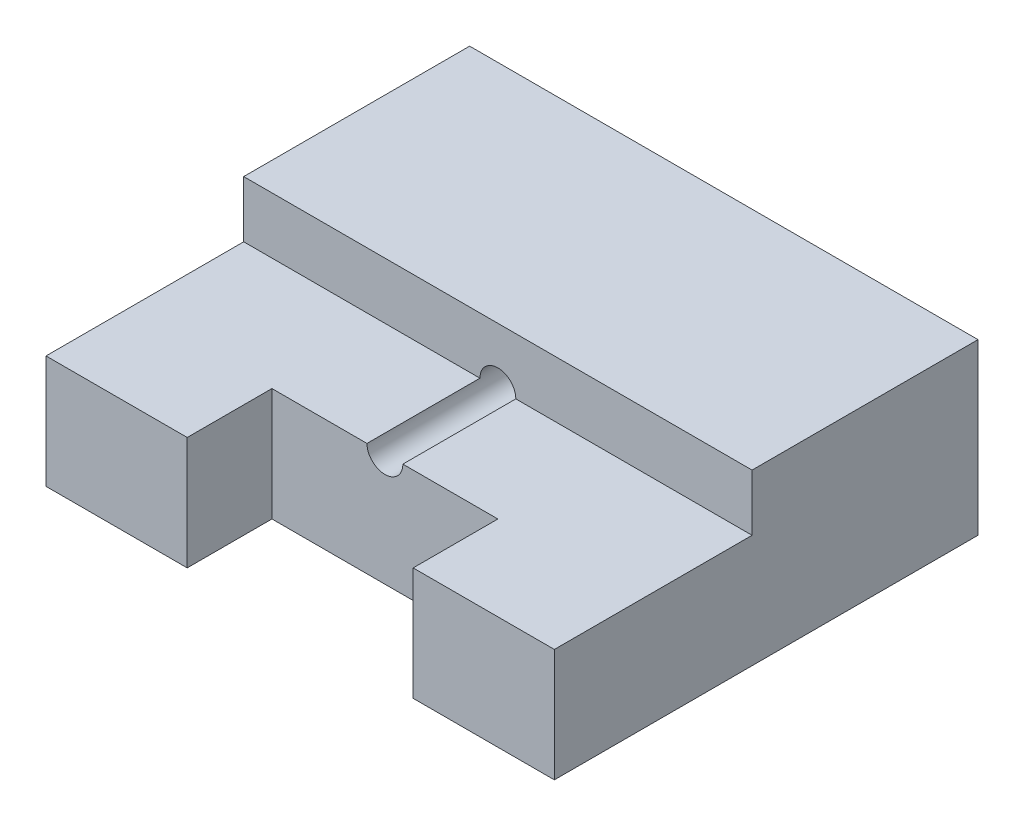
from build123d import *

# Parameters (mm, degrees)
SKETCH2_W           = 18
SKETCH2_H           = 15
BOSS_EXTRUDE2_DEPTH = 6
CUT_EXTRUDE3_DEPTH  = 2
SKETCH7_W           = 8
SKETCH7_H           = 3
CUT_EXTRUDE4_DEPTH  = 24.769728648
SKETCH12_R          = 0.635
CUT_EXTRUDE5_DEPTH  = 25.186773245


with BuildPart() as part:
    # Sketch2 → Boss-Extrude2 (new body)
    with BuildSketch(Plane(origin=(0, 0, 0), x_dir=(1, 0, 0), z_dir=(0, 1, 0))):
        with Locations((-9, 7.5)):
            Rectangle(SKETCH2_W, SKETCH2_H)
    extrude(amount=BOSS_EXTRUDE2_DEPTH)

    # Sketch6 → Cut-Extrude3 (cut)
    with BuildSketch(Plane(origin=(0, 6, 0), x_dir=(1, 0, 0), z_dir=(0, 1, 0))):
        Polygon((0, 7), (0, 0), (-2, 0), (-18, 0), (-18, 7), (-2, 7), align=None)
    extrude(amount=-CUT_EXTRUDE3_DEPTH, mode=Mode.SUBTRACT)

    # Sketch7 → Cut-Extrude4 (cut, through all)
    with BuildSketch(Plane(origin=(0, 4, 0), x_dir=(1, 0, 0), z_dir=(0, 1, 0))):
        with Locations((-9, 1.5)):
            Rectangle(SKETCH7_W, SKETCH7_H)
    extrude(amount=-CUT_EXTRUDE4_DEPTH, mode=Mode.SUBTRACT)

    # Sketch12 → Cut-Extrude5 (cut, through all)
    with BuildSketch(Plane(origin=(0, 0, -15), x_dir=(-1, 0, 0), z_dir=(0, 0, -1))):
        with Locations((9, 4)):
            Circle(SKETCH12_R)
    extrude(amount=-CUT_EXTRUDE5_DEPTH, mode=Mode.SUBTRACT)


solid = part.part
